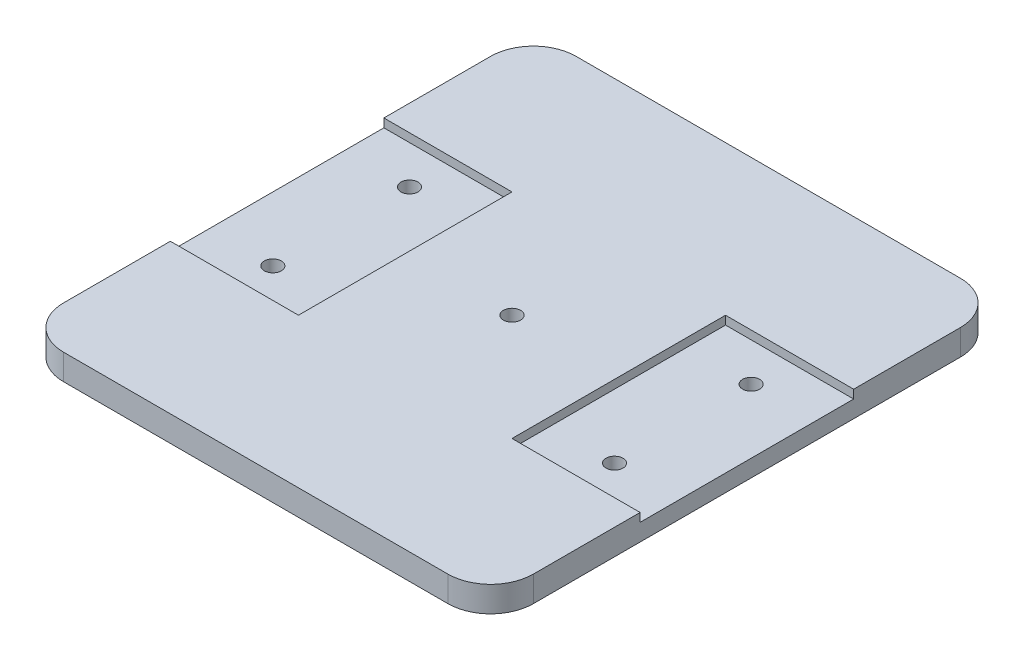
from build123d import *

# Parameters (mm, degrees)
SKETCH2_W           = 55
SKETCH2_H           = 60
BOSS_EXTRUDE1_DEPTH = 3
SKETCH3_W           = 15
SKETCH3_H           = 25
CUT_EXTRUDE1_DEPTH  = 1
SKETCH4_R           = 1
CUT_EXTRUDE3_DEPTH  = 5
FILLET1_R           = 5
SKETCH5_R           = 1
CUT_EXTRUDE4_DEPTH  = 5
SKETCH6_W           = 15
SKETCH6_H           = 25
CUT_EXTRUDE5_DEPTH  = 1
SKETCH7_R           = 1
CUT_EXTRUDE6_DEPTH  = 2


with BuildPart() as part:
    # Sketch2 → Boss-Extrude1 (new body)
    with BuildSketch(Plane(origin=(0, 0, 0), x_dir=(1, 0, 0), z_dir=(0, 1, 0))):
        with Locations((-50.625, -5.625)):
            Rectangle(SKETCH2_W, SKETCH2_H)
    extrude(amount=BOSS_EXTRUDE1_DEPTH)

    # Sketch3 → Cut-Extrude1 (cut)
    with BuildSketch(Plane(origin=(0, 3, 0), x_dir=(1, 0, 0), z_dir=(0, 1, 0))):
        with Locations((-70.625, -5.625)):
            Rectangle(SKETCH3_W, SKETCH3_H)
    extrude(amount=-CUT_EXTRUDE1_DEPTH, mode=Mode.SUBTRACT)

    # Sketch4 → Cut-Extrude3 (cut)
    with BuildSketch(Plane(origin=(0, 3, 0), x_dir=(1, 0, 0), z_dir=(0, 1, 0))):
        with Locations(Location((-70.625, 2.375, 0), (0, 0, 270))):
            Circle(SKETCH4_R)
        with Locations(Location((-70.625, -13.625, 0), (0, 0, 270))):
            Circle(SKETCH4_R)
    extrude(amount=-CUT_EXTRUDE3_DEPTH, mode=Mode.SUBTRACT)

    # Fillet1
    fillet1_edges = [part.edges().sort_by_distance(p)[0] for p in [
        (-78.125, 1.5, -24.375),
        (-23.125, 1.5, -24.375),
        (-23.125, 1.5, 35.625),
        (-78.125, 1.5, 35.625),
    ]]
    fillet(fillet1_edges, radius=FILLET1_R)

    # Sketch5 → Cut-Extrude4 (cut)
    with BuildSketch(Plane(origin=(0, 3, 0), x_dir=(1, 0, 0), z_dir=(0, 1, 0))):
        with Locations(Location((-50.625, -5.625, 0), (0, 0, 270))):
            Circle(SKETCH5_R)
    extrude(amount=-CUT_EXTRUDE4_DEPTH, mode=Mode.SUBTRACT)

    # Sketch6 → Cut-Extrude5 (cut)
    with BuildSketch(Plane(origin=(0, 3, 0), x_dir=(1, 0, 0), z_dir=(0, 1, 0))):
        with Locations((-30.625, -5.625)):
            Rectangle(SKETCH6_W, SKETCH6_H)
    extrude(amount=-CUT_EXTRUDE5_DEPTH, mode=Mode.SUBTRACT)

    # Sketch7 → Cut-Extrude6 (cut)
    with BuildSketch(Plane(origin=(0, 2, 0), x_dir=(1, 0, 0), z_dir=(0, 1, 0))):
        with Locations(Location((-30.625, 2.375, 0), (0, 0, 270))):
            Circle(SKETCH7_R)
        with Locations(Location((-30.625, -13.625, 0), (0, 0, 270))):
            Circle(SKETCH7_R)
    extrude(amount=-CUT_EXTRUDE6_DEPTH, mode=Mode.SUBTRACT)


solid = part.part
